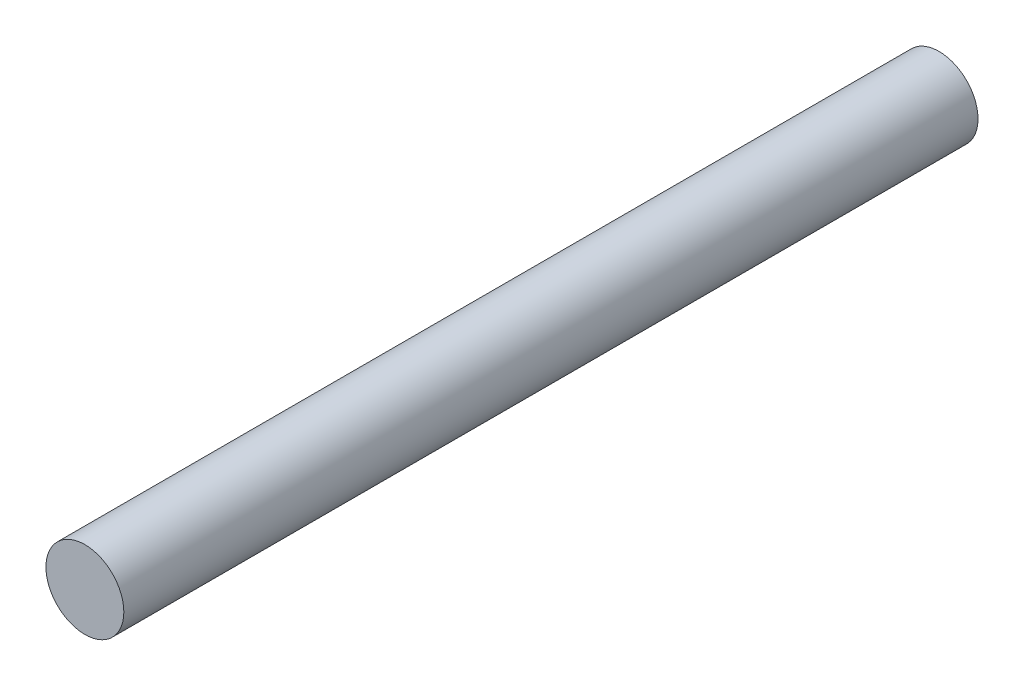
from build123d import *

# Parameters (mm, degrees)
SKETCH1_R           = 9.12
BOSS_EXTRUDE1_DEPTH = 200


with BuildPart() as part:
    # Sketch1 → Boss-Extrude1 (new body)
    with BuildSketch(Plane.XY):
        Circle(SKETCH1_R)
    extrude(amount=BOSS_EXTRUDE1_DEPTH)


solid = part.part
